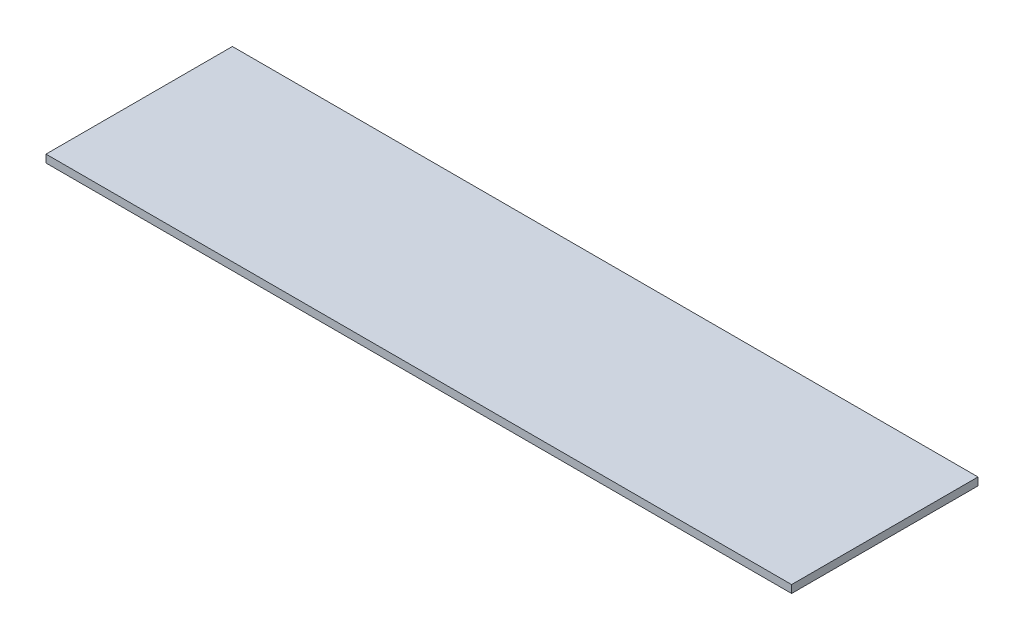
from build123d import *

# Parameters (mm, degrees)
SKETCH1_W           = 609.6
SKETCH1_H           = 152.4
BOSS_EXTRUDE1_DEPTH = 6.35


with BuildPart() as part:
    # Sketch1 → Boss-Extrude1 (new body)
    with BuildSketch(Plane(origin=(0, 0, 0), x_dir=(1, 0, 0), z_dir=(0, 1, 0))):
        Rectangle(SKETCH1_W, SKETCH1_H)
    extrude(amount=BOSS_EXTRUDE1_DEPTH)


solid = part.part
